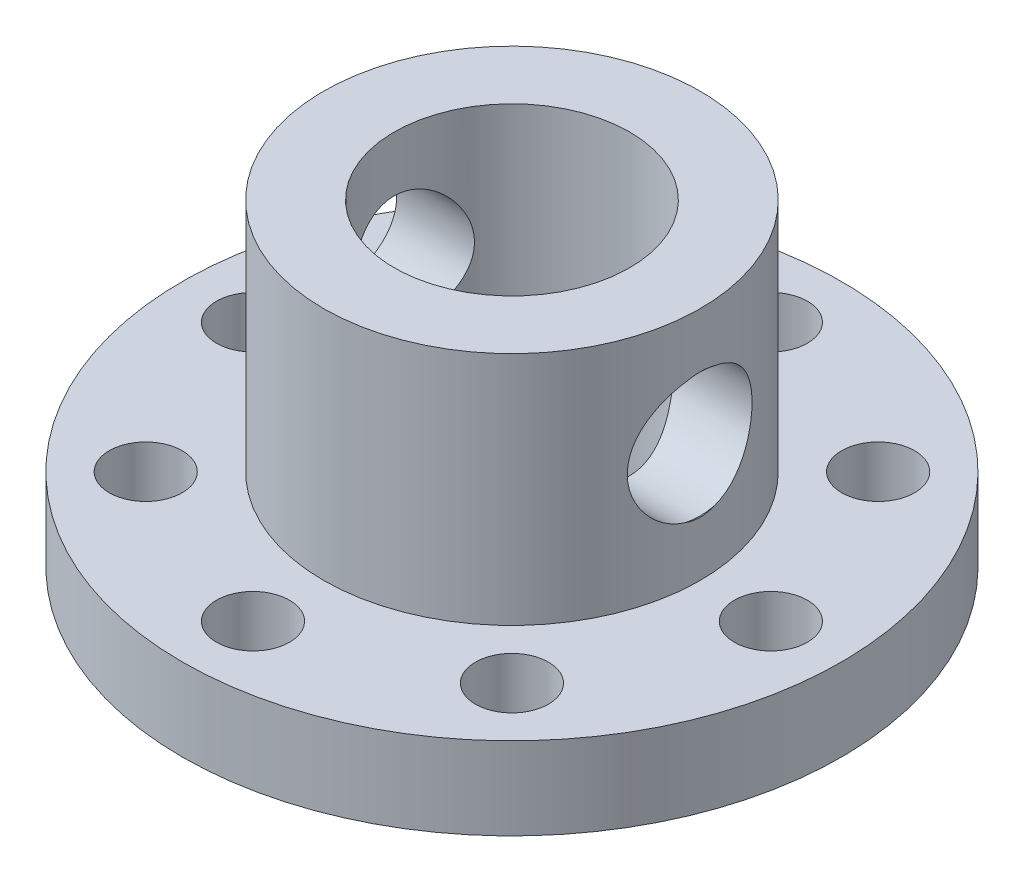
from build123d import *

# Parameters (mm, degrees)
SKETCH1_R                      = 14
BOSS_EXTRUDE1_DEPTH            = 1.75
M2_5_CLEARANCE_HOLE1_D         = 3.1
M2_5_CLEARANCE_HOLE1_DEPTH     = 6
M2_5_CLEARANCE_HOLE1_TIP       = 0.931333959
SKETCH9_R                      = 8
BOSS_EXTRUDE2_DEPTH            = 10
SKETCH7_R                      = 5
CUT_EXTRUDE1_DEPTH             = 24.963513933
M5_CLEARANCE_HOLE1_D           = 5.3
M5_CLEARANCE_HOLE1_DEPTH       = 25.4
M5_CLEARANCE_HOLE1_CSINK_D     = 5.35
M5_CLEARANCE_HOLE1_CSINK_ANGLE = 90
M5_CLEARANCE_HOLE1_TIP         = 1.59228064


with BuildPart() as part:
    # Sketch1 → Boss-Extrude1 (new, symmetric)
    with BuildSketch(Plane(origin=(0, 0, 0), x_dir=(1, 0, 0), z_dir=(0, 1, 0))):
        with Locations(Location((0, 0, 0), (0, 0, 270))):
            Circle(SKETCH1_R)
    extrude(amount=BOSS_EXTRUDE1_DEPTH, both=True)

    # M2.5 Clearance Hole1
    with Locations(Plane(origin=(0, 1.75, 0), x_dir=(1, 0, 0), z_dir=(0, 1, 0))):
        with Locations((-11, 0), (-7.778174593, 7.778174593), (0, 11), (7.778174593, 7.778174593), (11, 0), (7.778174593, -7.778174593), (0, -11), (-7.778174593, -7.778174593)):
            Hole(M2_5_CLEARANCE_HOLE1_D / 2, depth=M2_5_CLEARANCE_HOLE1_DEPTH)
            with Locations((0, 0, -(M2_5_CLEARANCE_HOLE1_DEPTH + M2_5_CLEARANCE_HOLE1_TIP / 2))):  # 118° drill point
                Cone(0, M2_5_CLEARANCE_HOLE1_D / 2, M2_5_CLEARANCE_HOLE1_TIP, mode=Mode.SUBTRACT)

    # Sketch9 → Boss-Extrude2 (add)
    with BuildSketch(Plane(origin=(0, 1.75, 0), x_dir=(1, 0, 0), z_dir=(0, 1, 0))):
        with Locations(Location((0, 0, 0), (0, 0, 270))):
            Circle(SKETCH9_R)
    extrude(amount=BOSS_EXTRUDE2_DEPTH)

    # Sketch7 → Cut-Extrude1 (cut, through all)
    with BuildSketch(Plane.XZ.offset(1.75)):
        with Locations(Location((0, 0, 0), (0, 0, 270))):
            Circle(SKETCH7_R)
    extrude(amount=-CUT_EXTRUDE1_DEPTH, mode=Mode.SUBTRACT)

    # M5 Clearance Hole1
    with Locations(Plane(origin=(8, 0, 0), x_dir=(0, 0, -1), z_dir=(1, 0, 0))):
        with Locations((0, 6.75)):
            CounterSinkHole(M5_CLEARANCE_HOLE1_D / 2, M5_CLEARANCE_HOLE1_CSINK_D / 2, depth=M5_CLEARANCE_HOLE1_DEPTH, counter_sink_angle=M5_CLEARANCE_HOLE1_CSINK_ANGLE)
            with Locations((0, 0, -(M5_CLEARANCE_HOLE1_DEPTH + M5_CLEARANCE_HOLE1_TIP / 2))):  # 118° drill point
                Cone(0, M5_CLEARANCE_HOLE1_D / 2, M5_CLEARANCE_HOLE1_TIP, mode=Mode.SUBTRACT)


solid = part.part
